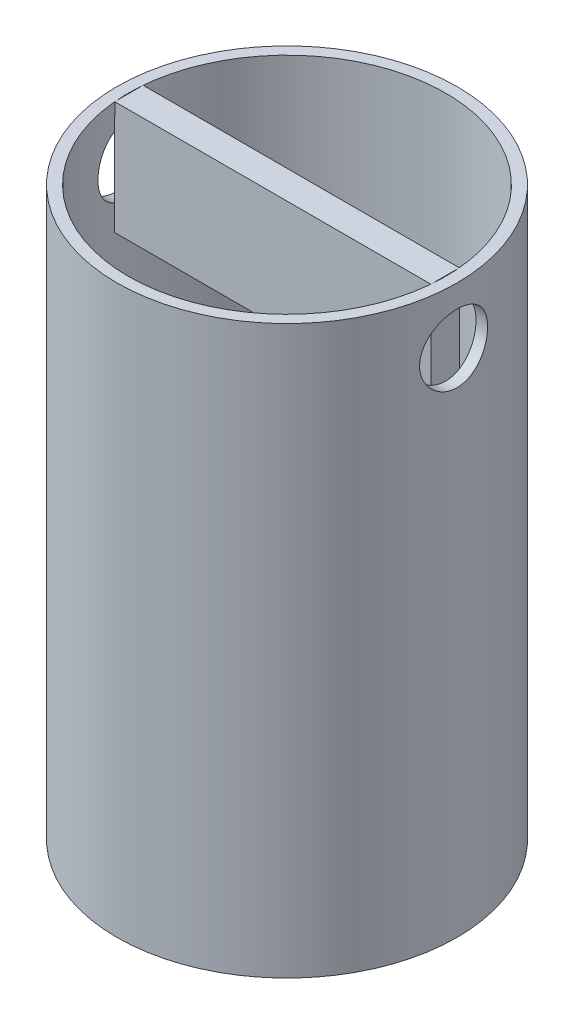
from build123d import *

# Parameters (mm, degrees)
SKETCH1_R           = 15
SKETCH1_R_2         = 14
BOSS_EXTRUDE1_DEPTH = 50
SKETCH2_R           = 3
CUT_EXTRUDE1_DEPTH  = 15
SKETCH3_W           = 27.887788492
SKETCH3_H           = 2.504247004
BOSS_EXTRUDE2_DEPTH = 10


with BuildPart() as part:
    # Sketch1 → Boss-Extrude1 (new body)
    with BuildSketch(Plane(origin=(0, 0, 0), x_dir=(1, 0, 0), z_dir=(0, 1, 0))):
        with Locations(Location((0, 0, 0), (0, 0, 270))):
            Circle(SKETCH1_R)
        with Locations(Location((0, 0, 0), (0, 0, 270))):
            Circle(SKETCH1_R_2, mode=Mode.SUBTRACT)
    extrude(amount=BOSS_EXTRUDE1_DEPTH)

    # Sketch2 → Cut-Extrude1 (cut, symmetric)
    with BuildSketch(Plane(origin=(0, 0, 0), x_dir=(0, 0, -1), z_dir=(1, 0, 0))):
        with Locations((0, 45)):
            Circle(SKETCH2_R)
    extrude(amount=CUT_EXTRUDE1_DEPTH, both=True, mode=Mode.SUBTRACT)


with BuildPart() as body_2:
    # Sketch3 → Boss-Extrude2 (new body)
    with BuildSketch(Plane(origin=(0, 50, 0), x_dir=(1, 0, 0), z_dir=(0, 1, 0))):
        Rectangle(SKETCH3_W, SKETCH3_H)
    extrude(amount=-BOSS_EXTRUDE2_DEPTH)


solid = Compound([part.part, body_2.part])
